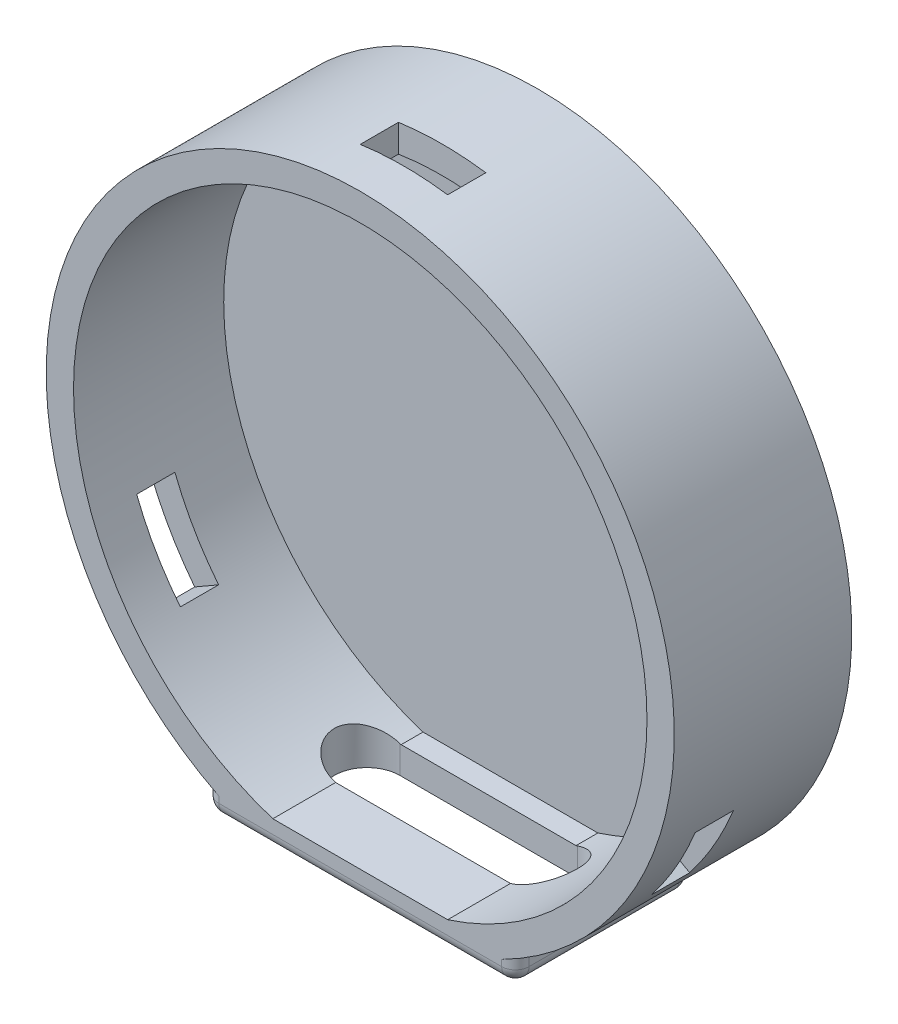
from build123d import *

# Parameters (mm, degrees)
SKETCH_1_R               = 11.5
EXTRUDE_1_DEPTH          = 1
EXTRUDE_START            = 5.5
SKETCH_2_R               = 11.5
SKETCH_2_R_2             = 10.5
EXTRUDE_1_2_DEPTH        = 5.5
CUT_EXTRUDE_2_DEPTH      = 18.168284713
CUT_EXTRUDE_2_DEPTH_BACK = 18.168284713
SKETCH_6_W               = 12.5
SKETCH_6_H               = 2.5
EXTRUDE_START_2          = -10
SKETCH_7_W               = 11.357816692
SKETCH_7_H               = 6.5
EXTRUDE_2_DEPTH          = 1
CUT_EXTRUDE_1_DEPTH      = 18.168284713
FILLET_2_R               = 0.5
SKETCH_9_W               = 3.2
SKETCH_9_H               = 1.4
CUT_EXTRUDE_3_DEPTH      = 18.168284879
PATTERN_CIRCULAR_1_COUNT = 3


with BuildPart() as part:
    # 草图1 → Extrude 1 (new body)
    with BuildSketch(Plane.XY):
        Circle(SKETCH_1_R)
    extrude(amount=-EXTRUDE_1_DEPTH)

    # 草图2 → Extrude 1 2 (add)
    with BuildSketch(Plane.XY.offset(EXTRUDE_START)):
        Circle(SKETCH_2_R)
        Circle(SKETCH_2_R_2, mode=Mode.SUBTRACT)
    extrude(amount=-EXTRUDE_1_2_DEPTH)

    # 草图6 → 切除-拉伸2 (cut, two sides: drawn at the far end of the back side and taken through both)
    with BuildSketch(Plane.XY.offset(-CUT_EXTRUDE_2_DEPTH_BACK)):
        with Locations((0, -11.25)):
            Rectangle(SKETCH_6_W, SKETCH_6_H)
    extrude(amount=CUT_EXTRUDE_2_DEPTH + CUT_EXTRUDE_2_DEPTH_BACK, mode=Mode.SUBTRACT)

    # 草图7 → 凸台-拉伸2 (add)
    with BuildSketch(Plane(origin=(0, 0, 0), x_dir=(1, 0, 0), z_dir=(0, 1, 0)).offset(EXTRUDE_START_2)):
        with Locations((0, -2.25)):
            Rectangle(SKETCH_7_W, SKETCH_7_H)
    extrude(amount=-EXTRUDE_2_DEPTH)

    # 草图3 → 切除-拉伸1 (cut, through all)
    with BuildSketch(Plane(origin=(0, 0, 0), x_dir=(1, 0, 0), z_dir=(0, 1, 0))):
        with BuildLine():
            Line((-3.25, -0.8), (3.25, -0.8))
            ThreePointArc((3.25, -0.8), (4.45, -2), (3.25, -3.2))
            Line((3.25, -3.2), (-3.25, -3.2))
            ThreePointArc((-3.25, -3.2), (-4.45, -2), (-3.25, -0.8))
        make_face()
    extrude(amount=-CUT_EXTRUDE_1_DEPTH, mode=Mode.SUBTRACT)

    # 圆角2
    fillet_2_edges = [part.edges().sort_by_distance(p)[0] for p in [
        (0, -11, -1),
        (-5.678908346, -10.5, -1),
        (5.678908346, -11, 2.25),
        (5.678908346, -10.5, -1),
        (0, -11, 5.5),
        (5.678908346, -10.5, 5.5),
        (-5.678908346, -11, 2.25),
        (-5.678908346, -10.5, 5.5),
    ]]
    fillet(fillet_2_edges, radius=FILLET_2_R)

    # 草图9 → 切除-拉伸3 (cut, through all)
    with BuildSketch(Plane(origin=(0, 0, 0), x_dir=(1, 0, 0), z_dir=(0, 1, 0))):
        with Locations((0, -3.2)):
            Rectangle(SKETCH_9_W, SKETCH_9_H)
    cut_extrude_3 = extrude(amount=CUT_EXTRUDE_3_DEPTH, mode=Mode.SUBTRACT)

    # 阵列(圆周)1: 切除-拉伸3 ×3 about axis
    pattern_circular_1_axis = Axis((0, 0, 0), (0, 0, 1))
    for i in range(1, PATTERN_CIRCULAR_1_COUNT):
        add(cut_extrude_3.rotate(pattern_circular_1_axis, i * 360 / PATTERN_CIRCULAR_1_COUNT), mode=Mode.SUBTRACT)


solid = part.part
